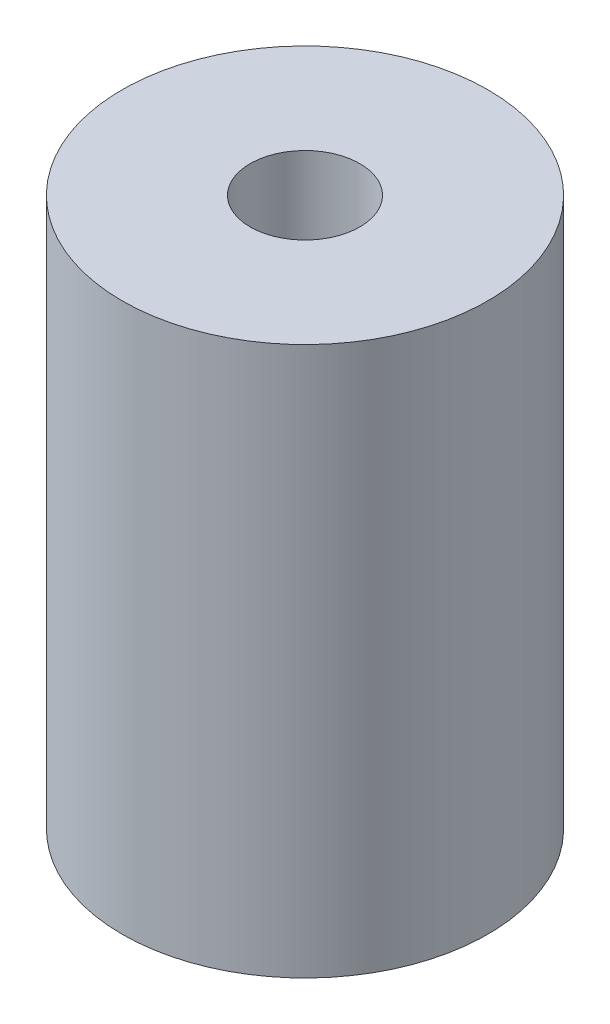
from build123d import *

# Parameters (mm, degrees)
SKETCH_1_R      = 10
SKETCH_1_R_2    = 3
EXTRUDE_1_DEPTH = 30


with BuildPart() as part:
    # 草图1 → 凸台-拉伸1 (new body)
    with BuildSketch(Plane(origin=(0, 0, 0), x_dir=(1, 0, 0), z_dir=(0, 1, 0))):
        with Locations(Location((0, 0, 0), (0, 0, 270))):
            Circle(SKETCH_1_R)
        with Locations(Location((0, 0, 0), (0, 0, 270))):
            Circle(SKETCH_1_R_2, mode=Mode.SUBTRACT)
    extrude(amount=EXTRUDE_1_DEPTH)


solid = part.part
